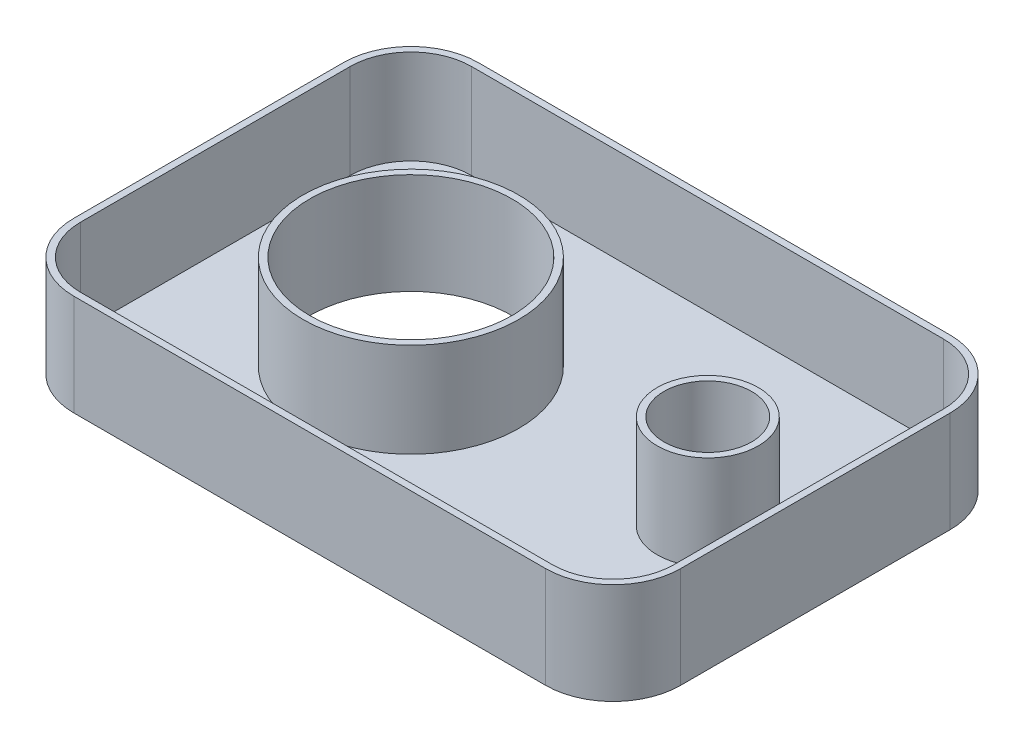
from build123d import *

# Parameters (mm, degrees)
SKETCH1_W           = 180
SKETCH1_H           = 120
BOSS_EXTRUDE1_DEPTH = 30
SKETCH4_R           = 30
SKETCH4_R_2         = 13
CUT_EXTRUDE1_DEPTH  = 219.403296678
FILLET1_R           = 20
SHELL2_T            = -2


with BuildPart() as part:
    # Sketch1 → Boss-Extrude1 (new body)
    with BuildSketch(Plane(origin=(0, 0, 0), x_dir=(1, 0, 0), z_dir=(0, 1, 0))):
        with Locations((90, -60)):
            Rectangle(SKETCH1_W, SKETCH1_H)
    extrude(amount=BOSS_EXTRUDE1_DEPTH)

    # Sketch4 → Cut-Extrude1 (cut, through all)
    with BuildSketch(Plane(origin=(0, 30, 0), x_dir=(1, 0, 0), z_dir=(0, 1, 0))):
        with Locations(Location((60, -60, 0), (0, 0, 270))):
            Circle(SKETCH4_R)
        with Locations(Location((145, -56.926363362, 0), (0, 0, 270))):
            Circle(SKETCH4_R_2)
    extrude(amount=-CUT_EXTRUDE1_DEPTH, mode=Mode.SUBTRACT)

    # Fillet1
    fillet1_edges = [part.edges().sort_by_distance(p)[0] for p in [
        (0, 15, 0),
        (180, 15, 0),
        (180, 15, 120),
        (0, 15, 120),
    ]]
    fillet(fillet1_edges, radius=FILLET1_R)

    # Shell2
    shell2_openings = [part.faces().sort_by_distance(p)[0] for p in [
        (93.107668166, 30, 60.091175454),
    ]]
    offset(amount=SHELL2_T, openings=shell2_openings, kind=Kind.INTERSECTION)


solid = part.part
